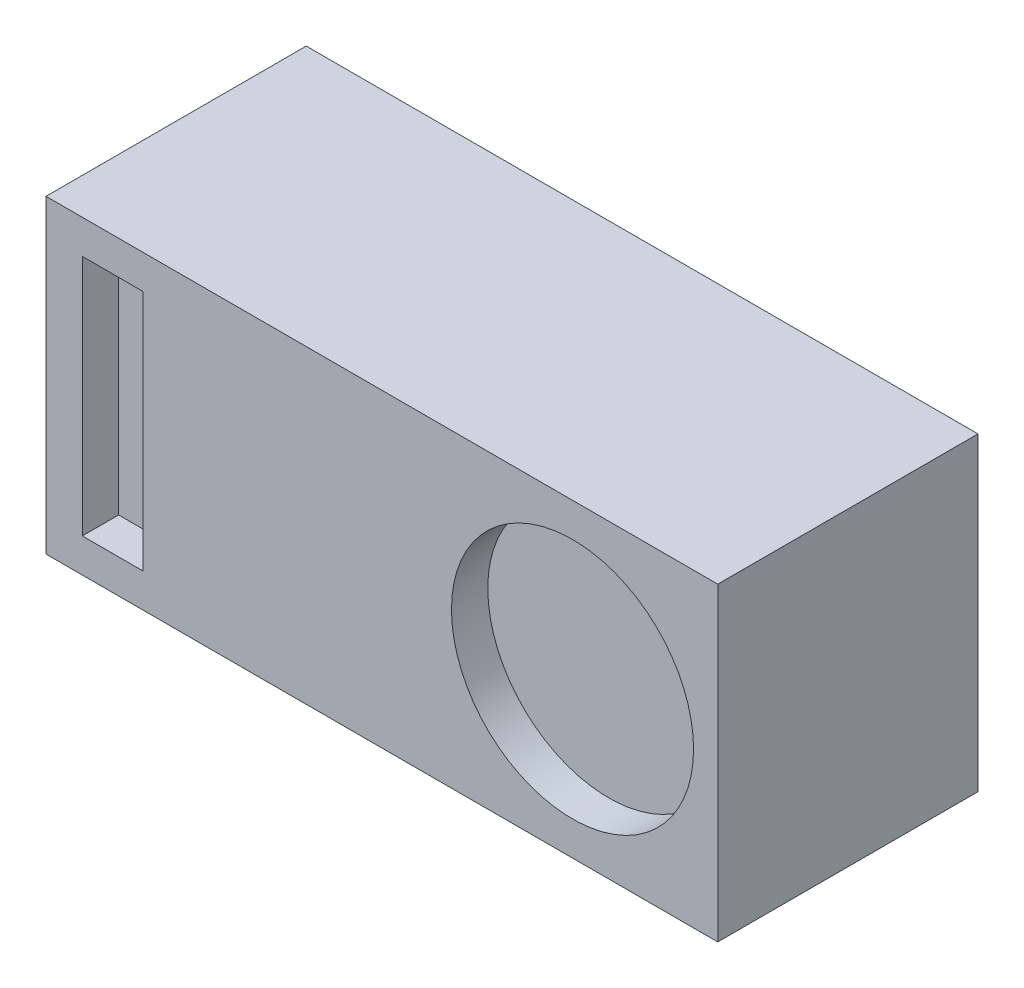
from build123d import *

# Parameters (mm, degrees)
SKETCH1_W           = 55.5
SKETCH1_H           = 25.6
SKETCH1_R           = 10
SKETCH1_W_2         = 5
SKETCH1_H_2         = 20
BOSS_EXTRUDE1_DEPTH = 21.5
SKETCH1_2_W         = 5
SKETCH1_2_H         = 20
SKETCH1_2_R         = 10
BOSS_EXTRUDE2_DEPTH = 18.5


with BuildPart() as part:
    # Sketch1 → Boss-Extrude1 (new body)
    with BuildSketch(Plane.XY):
        Rectangle(SKETCH1_W, SKETCH1_H)
        with Locations((15.75, 0)):
            Circle(SKETCH1_R, mode=Mode.SUBTRACT)
        with Locations((-22.25, 0)):
            Rectangle(SKETCH1_W_2, SKETCH1_H_2, mode=Mode.SUBTRACT)
    extrude(amount=BOSS_EXTRUDE1_DEPTH)

    # Sketch1<2> → Boss-Extrude2 (add)
    with BuildSketch(Plane.XY):
        with Locations((-22.25, 0)):
            Rectangle(SKETCH1_2_W, SKETCH1_2_H)
        with Locations(Location((15.75, 0, 0), (0, 0, 180))):
            Circle(SKETCH1_2_R)
    extrude(amount=BOSS_EXTRUDE2_DEPTH)


solid = part.part
